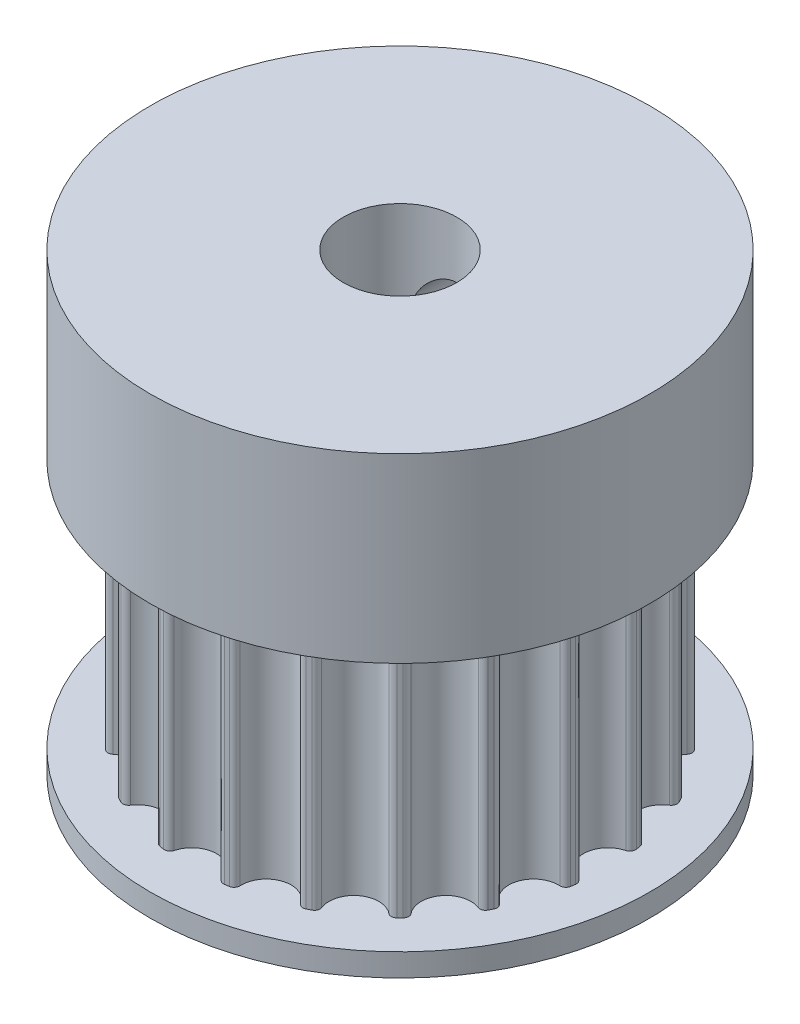
from build123d import *

# Parameters (mm, degrees)
SKETCH_1_R               = 9.17
EXTRUDE_1_DEPTH          = 11
CUT_EXTRUDE_1_DEPTH      = 11
PATTERN_CIRCULAR_1_COUNT = 20
SKETCH_4_R               = 11
EXTRUDE_3_DEPTH          = 8
EXTRUDE_START            = 1
SKETCH_3_R               = 11
EXTRUDE_4_DEPTH          = 1
SKETCH_5_R               = 2.5
CUT_EXTRUDE_2_DEPTH      = 22
SKETCH_6_R               = 1.5
CUT_EXTRUDE_3_DEPTH      = 30


with BuildPart() as part:
    # 草图1 → 凸台-拉伸1 (new body)
    with BuildSketch(Plane(origin=(0, 0, 0), x_dir=(1, 0, 0), z_dir=(0, 1, 0))):
        with Locations(Location((0, 0, 0), (0, 0, 270))):
            Circle(SKETCH_1_R)
    extrude(amount=-EXTRUDE_1_DEPTH)

    # 草图2 → 切除-拉伸1 (cut)
    with BuildSketch(Plane(origin=(0, 0, 0), x_dir=(1, 0, 0), z_dir=(0, 1, 0))):
        with BuildLine():
            Line((-1.338469592, 9.071791397), (-1.301979145, 9.548134799))
            Line((-1.301979145, 9.548134799), (1.164461041, 9.508969944))
            Line((1.164461041, 9.508969944), (1.338469592, 9.071791397))
            ThreePointArc((1.338469592, 9.071791397), (1.164461041, 9.03324808), (1.06034373, 8.888596261))
            ThreePointArc((1.06034373, 8.888596261), (0, 8.072950826), (-1.06034373, 8.888596261))
            ThreePointArc((-1.06034373, 8.888596261), (-1.164461041, 9.03324808), (-1.338469592, 9.071791397))
        make_face()
    cut_extrude_1 = extrude(amount=-CUT_EXTRUDE_1_DEPTH, mode=Mode.SUBTRACT)

    # 阵列(圆周)1: 切除-拉伸1 ×20 about axis
    pattern_circular_1_axis = Axis((0, 0, 0), (0, 1, 0))
    for i in range(1, PATTERN_CIRCULAR_1_COUNT):
        add(cut_extrude_1.rotate(pattern_circular_1_axis, i * 360 / PATTERN_CIRCULAR_1_COUNT), mode=Mode.SUBTRACT)

    # 草图4 → 凸台-拉伸3 (add)
    with BuildSketch(Plane(origin=(0, 0, 0), x_dir=(1, 0, 0), z_dir=(0, 1, 0))):
        with Locations(Location((0, 0, 0), (0, 0, 270))):
            Circle(SKETCH_4_R)
    extrude(amount=EXTRUDE_3_DEPTH)

    # 草图3 → 凸台-拉伸4 (add)
    with BuildSketch(Plane.XZ.offset(11).offset(EXTRUDE_START)):
        with Locations(Location((0, 0, 0), (0, 0, 90))):
            Circle(SKETCH_3_R)
    extrude(amount=-EXTRUDE_4_DEPTH)

    # 草图5 → 切除-拉伸2 (cut)
    with BuildSketch(Plane(origin=(0, 8, 0), x_dir=(1, 0, 0), z_dir=(0, 1, 0))):
        with Locations(Location((0, 0, 0), (0, 0, 270))):
            Circle(SKETCH_5_R)
    extrude(amount=-CUT_EXTRUDE_2_DEPTH, mode=Mode.SUBTRACT)

    # 草图6 → 切除-拉伸3 (cut)
    with BuildSketch(Plane.XY):
        with Locations((0, 4)):
            Circle(SKETCH_6_R)
    extrude(amount=-CUT_EXTRUDE_3_DEPTH, mode=Mode.SUBTRACT)


solid = part.part
